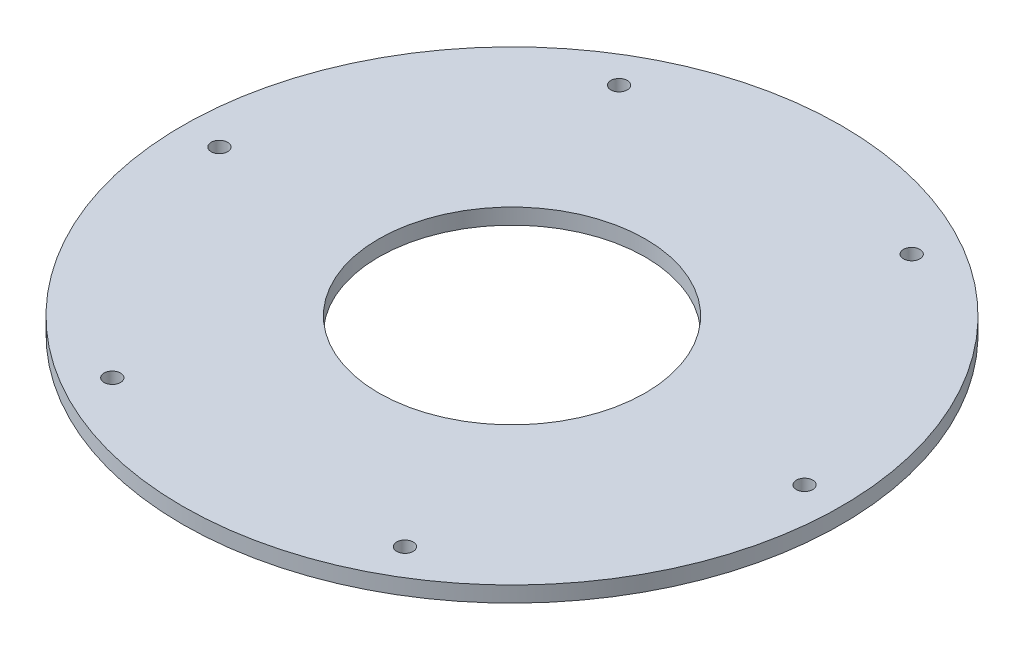
from build123d import *

# Parameters (mm, degrees)
SKETCH2_R           = 42
SKETCH2_R_2         = 1.05
SKETCH2_R_3         = 17
BOSS_EXTRUDE1_DEPTH = 2


with BuildPart() as part:
    # Sketch2 → Boss-Extrude1 (new body)
    with BuildSketch(Plane(origin=(0, 0, 0), x_dir=(1, 0, 0), z_dir=(0, 1, 0))):
        with Locations(Location((0, 0, 0), (0, 0, 270))):
            Circle(SKETCH2_R)
        with Locations(Location((-37.2875, 0, 0), (0, 0, 270))):
            Circle(SKETCH2_R_2, mode=Mode.SUBTRACT)
        with Locations(Location((-18.64375, 32.291922244, 0), (0, 0, 270))):
            Circle(SKETCH2_R_2, mode=Mode.SUBTRACT)
        with Locations(Location((18.64375, 32.291922244, 0), (0, 0, 270))):
            Circle(SKETCH2_R_2, mode=Mode.SUBTRACT)
        with Locations(Location((37.2875, 0, 0), (0, 0, 270))):
            Circle(SKETCH2_R_2, mode=Mode.SUBTRACT)
        with Locations(Location((18.64375, -32.291922244, 0), (0, 0, 270))):
            Circle(SKETCH2_R_2, mode=Mode.SUBTRACT)
        with Locations(Location((-18.64375, -32.291922244, 0), (0, 0, 270))):
            Circle(SKETCH2_R_2, mode=Mode.SUBTRACT)
        with Locations(Location((0, 0, 0), (0, 0, 270))):
            Circle(SKETCH2_R_3, mode=Mode.SUBTRACT)
    extrude(amount=BOSS_EXTRUDE1_DEPTH)


solid = part.part
